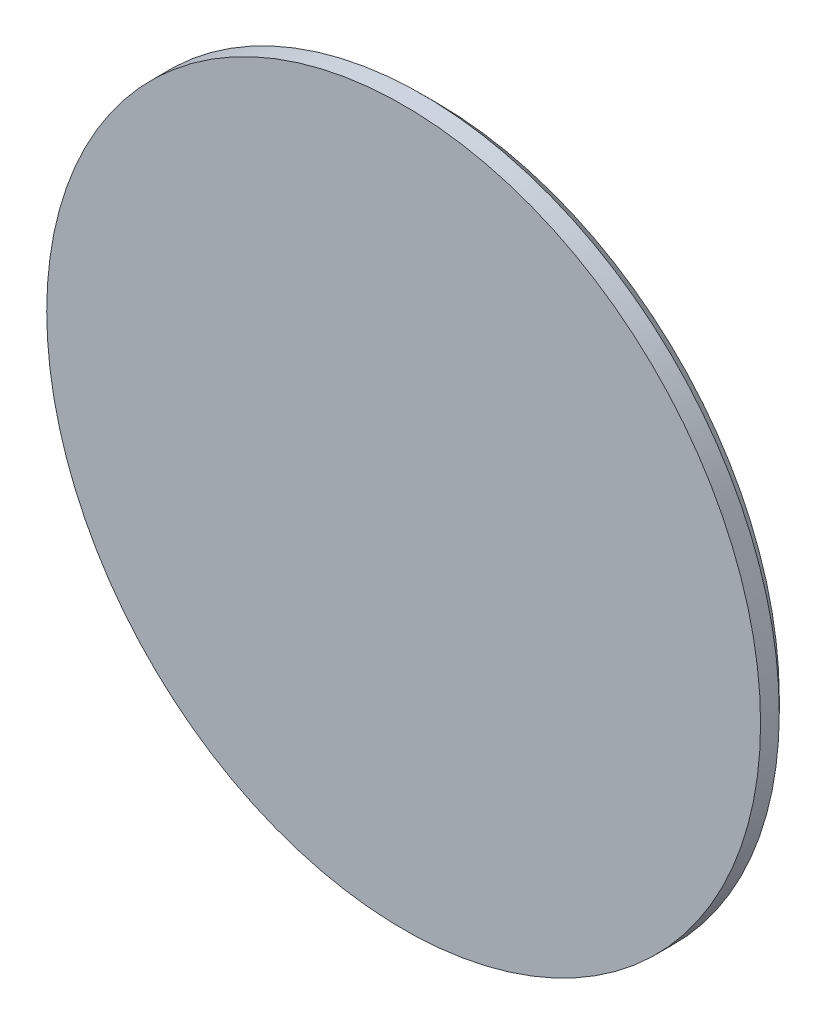
from build123d import *

# Parameters (mm, degrees)
SKETCH1_R           = 33
BOSS_EXTRUDE1_DEPTH = 3
CHAMFER1_SIZE       = 1.27


with BuildPart() as part:
    # Sketch1 → Boss-Extrude1 (new body)
    with BuildSketch(Plane.XY):
        with Locations((-27.434699442, 18.339500171)):
            Circle(SKETCH1_R)
    extrude(amount=BOSS_EXTRUDE1_DEPTH)

    # Chamfer1
    chamfer1_edges = [part.edges().sort_by_distance(p)[0] for p in [
        (-60.434699442, 18.339500171, 0),
    ]]
    chamfer(chamfer1_edges, length=CHAMFER1_SIZE)


solid = part.part
